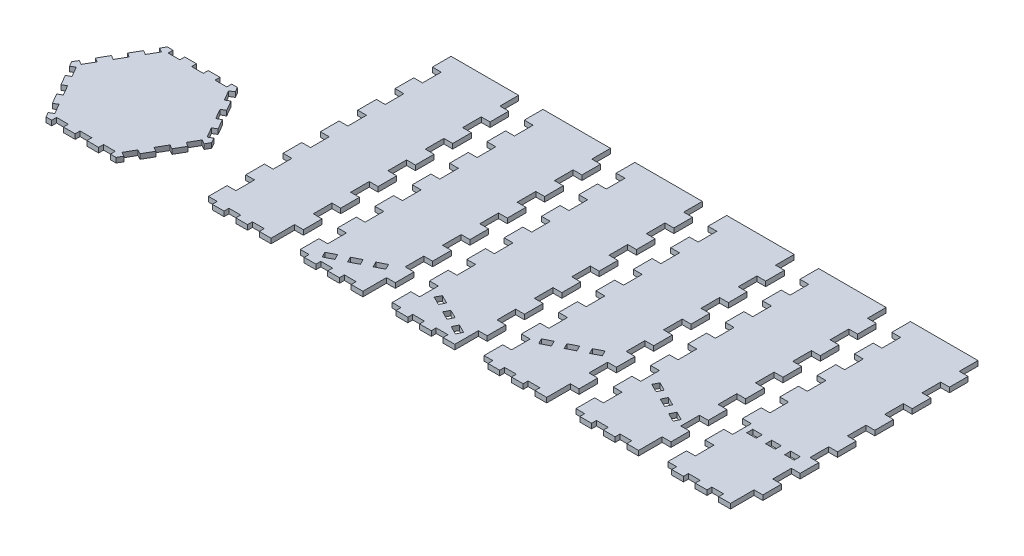
from build123d import *

# Parameters (mm, degrees)
BOSS_EXTRUDE3_DEPTH   = 3.2
BOSS_EXTRUDE3_2_DEPTH = 3.2
BOSS_EXTRUDE3_3_DEPTH = 3.2
BOSS_EXTRUDE3_4_DEPTH = 3.2
BOSS_EXTRUDE3_5_DEPTH = 3.2
BOSS_EXTRUDE3_6_DEPTH = 3.2
SKETCH1_W             = 6.2
SKETCH1_H             = 4
BOSS_EXTRUDE3_7_DEPTH = 3.2


with BuildPart() as part:
    # Sketch1 → Boss-Extrude3 (new body)
    with BuildSketch(Plane(origin=(0, 0, 0), x_dir=(1, 0, 0), z_dir=(0, 1, 0))):
        Polygon((-22.869998863, -39.612), (-19.17495714, -39.612), (-19.17495714, -36.412), (-11.504974284, -36.412), (-11.504974284, -39.612), (-3.834991428, -39.612), (-3.834991428, -36.412), (3.834991428, -36.412), (3.834991428, -39.612), (11.504974284, -39.612), (11.504974284, -36.412), (19.17495714, -36.412), (19.17495714, -39.612), (22.869998863, -39.612), (24.717519725, -36.412), (21.946238432, -34.812), (25.781229861, -28.1696), (28.552511153, -29.7696), (32.387502581, -23.1272), (29.616221289, -21.5272), (33.451212717, -14.8848), (36.222494009, -16.4848), (40.057485437, -9.8424), (37.286204145, -8.2424), (41.121195573, -1.6), (43.892476865, -3.2), (45.739997726, 0), (43.892476865, 3.2), (41.121195573, 1.6), (37.286204145, 8.2424), (40.057485437, 9.8424), (36.222494009, 16.4848), (33.451212717, 14.8848), (29.616221289, 21.5272), (32.387502581, 23.1272), (28.552511153, 29.7696), (25.781229861, 28.1696), (21.946238432, 34.812), (24.717519725, 36.412), (22.869998863, 39.612), (19.17495714, 39.612), (19.17495714, 36.412), (11.504974284, 36.412), (11.504974284, 39.612), (3.834991428, 39.612), (3.834991428, 36.412), (-3.834991428, 36.412), (-3.834991428, 39.612), (-11.504974284, 39.612), (-11.504974284, 36.412), (-19.17495714, 36.412), (-19.17495714, 39.612), (-22.869998863, 39.612), (-24.717519725, 36.412), (-21.946238432, 34.812), (-25.781229861, 28.1696), (-28.552511153, 29.7696), (-32.387502581, 23.1272), (-29.616221289, 21.5272), (-33.451212717, 14.8848), (-36.222494009, 16.4848), (-40.057485437, 9.8424), (-37.286204145, 8.2424), (-41.121195573, 1.6), (-43.892476865, 3.2), (-45.739997726, 0), (-43.892476865, -3.2), (-41.121195573, -1.6), (-37.286204145, -8.2424), (-40.057485437, -9.8424), (-36.222494009, -16.4848), (-33.451212717, -14.8848), (-29.616221289, -21.5272), (-32.387502581, -23.1272), (-28.552511153, -29.7696), (-25.781229861, -28.1696), (-21.946238432, -34.812), (-24.717519725, -36.412), align=None)
    extrude(amount=BOSS_EXTRUDE3_DEPTH)


with BuildPart() as body_2:
    # Sketch1 → Boss-Extrude3 2 (new body)
    with BuildSketch(Plane(origin=(0, 0, 0), x_dir=(1, 0, 0), z_dir=(0, 1, 0))):
        Polygon((80.811510634, -34.694704186), (88.48149349, -34.694704186), (88.48149349, -31.494704186), (96.151476346, -31.494704186), (96.151476346, -34.694704186), (103.821459202, -34.694704186), (103.821459202, -31.494704186), (111.491442058, -31.494704186), (111.491442058, -34.694704186), (119.161424915, -34.694704186), (119.161424915, -19.306396493), (124.903987499, -19.306396493), (124.903987499, -7.118088801), (119.161424915, -7.118088801), (119.161424915, 5.070218891), (124.903987499, 5.070218891), (124.903987499, 17.258526584), (119.161424915, 17.258526584), (119.161424915, 29.446834276), (124.903987499, 29.446834276), (124.903987499, 41.635141968), (119.161424915, 41.635141968), (119.161424915, 53.823449661), (124.903987499, 53.823449661), (124.903987499, 66.011757353), (119.161424915, 66.011757353), (119.161424915, 78.200065045), (124.903987499, 78.200065045), (124.903987499, 90.388372738), (119.161424915, 90.388372738), (119.161424915, 102.57668043), (124.903987499, 102.57668043), (124.903987499, 114.764988122), (119.161424915, 114.764988122), (119.161424915, 126.953295814), (75.06894805, 126.953295814), (75.06894805, 114.764988122), (80.811510634, 114.764988122), (80.811510634, 102.57668043), (75.06894805, 102.57668043), (75.06894805, 90.388372738), (80.811510634, 90.388372738), (80.811510634, 78.200065045), (75.06894805, 78.200065045), (75.06894805, 66.011757353), (80.811510634, 66.011757353), (80.811510634, 53.823449661), (75.06894805, 53.823449661), (75.06894805, 41.635141968), (80.811510634, 41.635141968), (80.811510634, 29.446834276), (75.06894805, 29.446834276), (75.06894805, 17.258526584), (80.811510634, 17.258526584), (80.811510634, 5.070218891), (75.06894805, 5.070218891), (75.06894805, -7.118088801), (80.811510634, -7.118088801), (80.811510634, -19.306396493), (75.06894805, -19.306396493), (75.06894805, -31.494704186), (80.811510634, -31.494704186), align=None)
    extrude(amount=BOSS_EXTRUDE3_2_DEPTH)


with BuildPart() as body_3:
    # Sketch1 → Boss-Extrude3 3 (new body)
    with BuildSketch(Plane(origin=(0, 0, 0), x_dir=(1, 0, 0), z_dir=(0, 1, 0))):
        Polygon((140.811510634, -34.694704186), (148.48149349, -34.694704186), (148.48149349, -31.494704186), (156.151476346, -31.494704186), (156.151476346, -34.694704186), (163.821459202, -34.694704186), (163.821459202, -31.494704186), (171.491442058, -31.494704186), (171.491442058, -34.694704186), (179.161424915, -34.694704186), (179.161424915, -19.306396493), (184.903987499, -19.306396493), (184.903987499, -7.118088801), (179.161424915, -7.118088801), (179.161424915, 5.070218891), (184.903987499, 5.070218891), (184.903987499, 17.258526584), (179.161424915, 17.258526584), (179.161424915, 29.446834276), (184.903987499, 29.446834276), (184.903987499, 41.635141968), (179.161424915, 41.635141968), (179.161424915, 53.823449661), (184.903987499, 53.823449661), (184.903987499, 66.011757353), (179.161424915, 66.011757353), (179.161424915, 78.200065045), (184.903987499, 78.200065045), (184.903987499, 90.388372738), (179.161424915, 90.388372738), (179.161424915, 102.57668043), (184.903987499, 102.57668043), (184.903987499, 114.764988122), (179.161424915, 114.764988122), (179.161424915, 126.953295814), (135.06894805, 126.953295814), (135.06894805, 114.764988122), (140.811510634, 114.764988122), (140.811510634, 102.57668043), (135.06894805, 102.57668043), (135.06894805, 90.388372738), (140.811510634, 90.388372738), (140.811510634, 78.200065045), (135.06894805, 78.200065045), (135.06894805, 66.011757353), (140.811510634, 66.011757353), (140.811510634, 53.823449661), (135.06894805, 53.823449661), (135.06894805, 41.635141968), (140.811510634, 41.635141968), (140.811510634, 29.446834276), (135.06894805, 29.446834276), (135.06894805, 17.258526584), (140.811510634, 17.258526584), (140.811510634, 5.070218891), (135.06894805, 5.070218891), (135.06894805, -7.118088801), (140.811510634, -7.118088801), (140.811510634, -19.306396493), (135.06894805, -19.306396493), (135.06894805, -31.494704186), (140.811510634, -31.494704186), align=None)
        Polygon((144.691390702, -25.05535193), (150.237092829, -22.283134782), (152.025620021, -25.861007123), (146.479917893, -28.63322427), align=None, mode=Mode.SUBTRACT)
        Polygon((155.782794957, -19.510917635), (161.328497085, -16.738700488), (163.117024276, -20.316572828), (157.571322149, -23.088789976), align=None, mode=Mode.SUBTRACT)
        Polygon((166.874199212, -13.966483341), (172.41990134, -11.194266194), (174.208428532, -14.772138534), (168.662726404, -17.544355681), align=None, mode=Mode.SUBTRACT)
    extrude(amount=BOSS_EXTRUDE3_3_DEPTH)


with BuildPart() as body_4:
    # Sketch1 → Boss-Extrude3 4 (new body)
    with BuildSketch(Plane(origin=(0, 0, 0), x_dir=(1, 0, 0), z_dir=(0, 1, 0))):
        Polygon((200.811510634, -34.694704186), (208.48149349, -34.694704186), (208.48149349, -31.494704186), (216.151476346, -31.494704186), (216.151476346, -34.694704186), (223.821459202, -34.694704186), (223.821459202, -31.494704186), (231.491442058, -31.494704186), (231.491442058, -34.694704186), (239.161424915, -34.694704186), (239.161424915, -19.306396493), (244.903987499, -19.306396493), (244.903987499, -7.118088801), (239.161424915, -7.118088801), (239.161424915, 5.070218891), (244.903987499, 5.070218891), (244.903987499, 17.258526584), (239.161424915, 17.258526584), (239.161424915, 29.446834276), (244.903987499, 29.446834276), (244.903987499, 41.635141968), (239.161424915, 41.635141968), (239.161424915, 53.823449661), (244.903987499, 53.823449661), (244.903987499, 66.011757353), (239.161424915, 66.011757353), (239.161424915, 78.200065045), (244.903987499, 78.200065045), (244.903987499, 90.388372738), (239.161424915, 90.388372738), (239.161424915, 102.57668043), (244.903987499, 102.57668043), (244.903987499, 114.764988122), (239.161424915, 114.764988122), (239.161424915, 126.953295814), (195.06894805, 126.953295814), (195.06894805, 114.764988122), (200.811510634, 114.764988122), (200.811510634, 102.57668043), (195.06894805, 102.57668043), (195.06894805, 90.388372738), (200.811510634, 90.388372738), (200.811510634, 78.200065045), (195.06894805, 78.200065045), (195.06894805, 66.011757353), (200.811510634, 66.011757353), (200.811510634, 53.823449661), (195.06894805, 53.823449661), (195.06894805, 41.635141968), (200.811510634, 41.635141968), (200.811510634, 29.446834276), (195.06894805, 29.446834276), (195.06894805, 17.258526584), (200.811510634, 17.258526584), (200.811510634, 5.070218891), (195.06894805, 5.070218891), (195.06894805, -7.118088801), (200.811510634, -7.118088801), (200.811510634, -19.306396493), (195.06894805, -19.306396493), (195.06894805, -31.494704186), (200.811510634, -31.494704186), align=None)
        Polygon((207.553034208, -11.194266194), (205.764507017, -14.772138534), (211.310209144, -17.544355681), (213.098736336, -13.966483341), align=None, mode=Mode.SUBTRACT)
        Polygon((218.644438464, -16.738700488), (216.855911272, -20.316572828), (222.4016134, -23.088789976), (224.190140591, -19.510917635), align=None, mode=Mode.SUBTRACT)
        Polygon((229.735842719, -22.283134782), (227.947315527, -25.861007123), (233.493017655, -28.63322427), (235.281544847, -25.05535193), align=None, mode=Mode.SUBTRACT)
    extrude(amount=BOSS_EXTRUDE3_4_DEPTH)


with BuildPart() as body_5:
    # Sketch1 → Boss-Extrude3 5 (new body)
    with BuildSketch(Plane(origin=(0, 0, 0), x_dir=(1, 0, 0), z_dir=(0, 1, 0))):
        Polygon((260.811510634, -34.694704186), (268.48149349, -34.694704186), (268.48149349, -31.494704186), (276.151476346, -31.494704186), (276.151476346, -34.694704186), (283.821459202, -34.694704186), (283.821459202, -31.494704186), (291.491442058, -31.494704186), (291.491442058, -34.694704186), (299.161424915, -34.694704186), (299.161424915, -19.306396493), (304.903987499, -19.306396493), (304.903987499, -7.118088801), (299.161424915, -7.118088801), (299.161424915, 5.070218891), (304.903987499, 5.070218891), (304.903987499, 17.258526584), (299.161424915, 17.258526584), (299.161424915, 29.446834276), (304.903987499, 29.446834276), (304.903987499, 41.635141968), (299.161424915, 41.635141968), (299.161424915, 53.823449661), (304.903987499, 53.823449661), (304.903987499, 66.011757353), (299.161424915, 66.011757353), (299.161424915, 78.200065045), (304.903987499, 78.200065045), (304.903987499, 90.388372738), (299.161424915, 90.388372738), (299.161424915, 102.57668043), (304.903987499, 102.57668043), (304.903987499, 114.764988122), (299.161424915, 114.764988122), (299.161424915, 126.953295814), (255.06894805, 126.953295814), (255.06894805, 114.764988122), (260.811510634, 114.764988122), (260.811510634, 102.57668043), (255.06894805, 102.57668043), (255.06894805, 90.388372738), (260.811510634, 90.388372738), (260.811510634, 78.200065045), (255.06894805, 78.200065045), (255.06894805, 66.011757353), (260.811510634, 66.011757353), (260.811510634, 53.823449661), (255.06894805, 53.823449661), (255.06894805, 41.635141968), (260.811510634, 41.635141968), (260.811510634, 29.446834276), (255.06894805, 29.446834276), (255.06894805, 17.258526584), (260.811510634, 17.258526584), (260.811510634, 5.070218891), (255.06894805, 5.070218891), (255.06894805, -7.118088801), (260.811510634, -7.118088801), (260.811510634, -19.306396493), (255.06894805, -19.306396493), (255.06894805, -31.494704186), (260.811510634, -31.494704186), align=None)
        Polygon((266.122212455, -6.902455299), (264.333685263, -3.324582959), (269.879387391, -0.552365811), (271.667914583, -4.130238152), align=None, mode=Mode.SUBTRACT)
        Polygon((275.425089519, 2.219851336), (277.21361671, -1.358021005), (282.759318838, 1.414196143), (280.970791646, 4.992068483), align=None, mode=Mode.SUBTRACT)
        Polygon((286.516493774, 7.76428563), (288.305020966, 4.18641329), (293.850723093, 6.958630437), (292.062195902, 10.536502777), align=None, mode=Mode.SUBTRACT)
    extrude(amount=BOSS_EXTRUDE3_5_DEPTH)


with BuildPart() as body_6:
    # Sketch1 → Boss-Extrude3 6 (new body)
    with BuildSketch(Plane(origin=(0, 0, 0), x_dir=(1, 0, 0), z_dir=(0, 1, 0))):
        Polygon((320.811510634, -34.694704186), (328.48149349, -34.694704186), (328.48149349, -31.494704186), (336.151476346, -31.494704186), (336.151476346, -34.694704186), (343.821459202, -34.694704186), (343.821459202, -31.494704186), (351.491442058, -31.494704186), (351.491442058, -34.694704186), (359.161424915, -34.694704186), (359.161424915, -19.306396493), (364.903987499, -19.306396493), (364.903987499, -7.118088801), (359.161424915, -7.118088801), (359.161424915, 5.070218891), (364.903987499, 5.070218891), (364.903987499, 17.258526584), (359.161424915, 17.258526584), (359.161424915, 29.446834276), (364.903987499, 29.446834276), (364.903987499, 41.635141968), (359.161424915, 41.635141968), (359.161424915, 53.823449661), (364.903987499, 53.823449661), (364.903987499, 66.011757353), (359.161424915, 66.011757353), (359.161424915, 78.200065045), (364.903987499, 78.200065045), (364.903987499, 90.388372738), (359.161424915, 90.388372738), (359.161424915, 102.57668043), (364.903987499, 102.57668043), (364.903987499, 114.764988122), (359.161424915, 114.764988122), (359.161424915, 126.953295814), (315.06894805, 126.953295814), (315.06894805, 114.764988122), (320.811510634, 114.764988122), (320.811510634, 102.57668043), (315.06894805, 102.57668043), (315.06894805, 90.388372738), (320.811510634, 90.388372738), (320.811510634, 78.200065045), (315.06894805, 78.200065045), (315.06894805, 66.011757353), (320.811510634, 66.011757353), (320.811510634, 53.823449661), (315.06894805, 53.823449661), (315.06894805, 41.635141968), (320.811510634, 41.635141968), (320.811510634, 29.446834276), (315.06894805, 29.446834276), (315.06894805, 17.258526584), (320.811510634, 17.258526584), (320.811510634, 5.070218891), (315.06894805, 5.070218891), (315.06894805, -7.118088801), (320.811510634, -7.118088801), (320.811510634, -19.306396493), (315.06894805, -19.306396493), (315.06894805, -31.494704186), (320.811510634, -31.494704186), align=None)
        Polygon((327.910739647, 10.536502777), (333.456441774, 7.76428563), (331.667914583, 4.18641329), (326.122212455, 6.958630437), align=None, mode=Mode.SUBTRACT)
        Polygon((339.002143902, 4.992068483), (344.54784603, 2.219851336), (342.759318838, -1.358021005), (337.21361671, 1.414196143), align=None, mode=Mode.SUBTRACT)
        Polygon((348.305020966, -4.130238152), (353.850723093, -6.902455299), (355.639250285, -3.324582959), (350.093548157, -0.552365811), align=None, mode=Mode.SUBTRACT)
    extrude(amount=BOSS_EXTRUDE3_6_DEPTH)


with BuildPart() as body_7:
    # Sketch1 → Boss-Extrude3 7 (new body)
    with BuildSketch(Plane(origin=(0, 0, 0), x_dir=(1, 0, 0), z_dir=(0, 1, 0))):
        Polygon((380.811510634, -34.694704186), (388.48149349, -34.694704186), (388.48149349, -31.494704186), (396.151476346, -31.494704186), (396.151476346, -34.694704186), (403.821459202, -34.694704186), (403.821459202, -31.494704186), (411.491442058, -31.494704186), (411.491442058, -34.694704186), (419.161424915, -34.694704186), (419.161424915, -19.306396493), (424.903987499, -19.306396493), (424.903987499, -7.118088801), (419.161424915, -7.118088801), (419.161424915, 5.070218891), (424.903987499, 5.070218891), (424.903987499, 17.258526584), (419.161424915, 17.258526584), (419.161424915, 29.446834276), (424.903987499, 29.446834276), (424.903987499, 41.635141968), (419.161424915, 41.635141968), (419.161424915, 53.823449661), (424.903987499, 53.823449661), (424.903987499, 66.011757353), (419.161424915, 66.011757353), (419.161424915, 78.200065045), (424.903987499, 78.200065045), (424.903987499, 90.388372738), (419.161424915, 90.388372738), (419.161424915, 102.57668043), (424.903987499, 102.57668043), (424.903987499, 114.764988122), (419.161424915, 114.764988122), (419.161424915, 126.953295814), (375.06894805, 126.953295814), (375.06894805, 114.764988122), (380.811510634, 114.764988122), (380.811510634, 102.57668043), (375.06894805, 102.57668043), (375.06894805, 90.388372738), (380.811510634, 90.388372738), (380.811510634, 78.200065045), (375.06894805, 78.200065045), (375.06894805, 66.011757353), (380.811510634, 66.011757353), (380.811510634, 53.823449661), (375.06894805, 53.823449661), (375.06894805, 41.635141968), (380.811510634, 41.635141968), (380.811510634, 29.446834276), (375.06894805, 29.446834276), (375.06894805, 17.258526584), (380.811510634, 17.258526584), (380.811510634, 5.070218891), (375.06894805, 5.070218891), (375.06894805, -7.118088801), (380.811510634, -7.118088801), (380.811510634, -19.306396493), (375.06894805, -19.306396493), (375.06894805, -31.494704186), (380.811510634, -31.494704186), align=None)
        with Locations((387.586467774, 12.545295814)):
            Rectangle(SKETCH1_W, SKETCH1_H, mode=Mode.SUBTRACT)
        with Locations((399.986467774, 12.545295814)):
            Rectangle(SKETCH1_W, SKETCH1_H, mode=Mode.SUBTRACT)
        with Locations((412.386467774, 12.545295814)):
            Rectangle(SKETCH1_W, SKETCH1_H, mode=Mode.SUBTRACT)
    extrude(amount=BOSS_EXTRUDE3_7_DEPTH)


solid = Compound([part.part, body_2.part, body_3.part, body_4.part, body_5.part, body_6.part, body_7.part])
